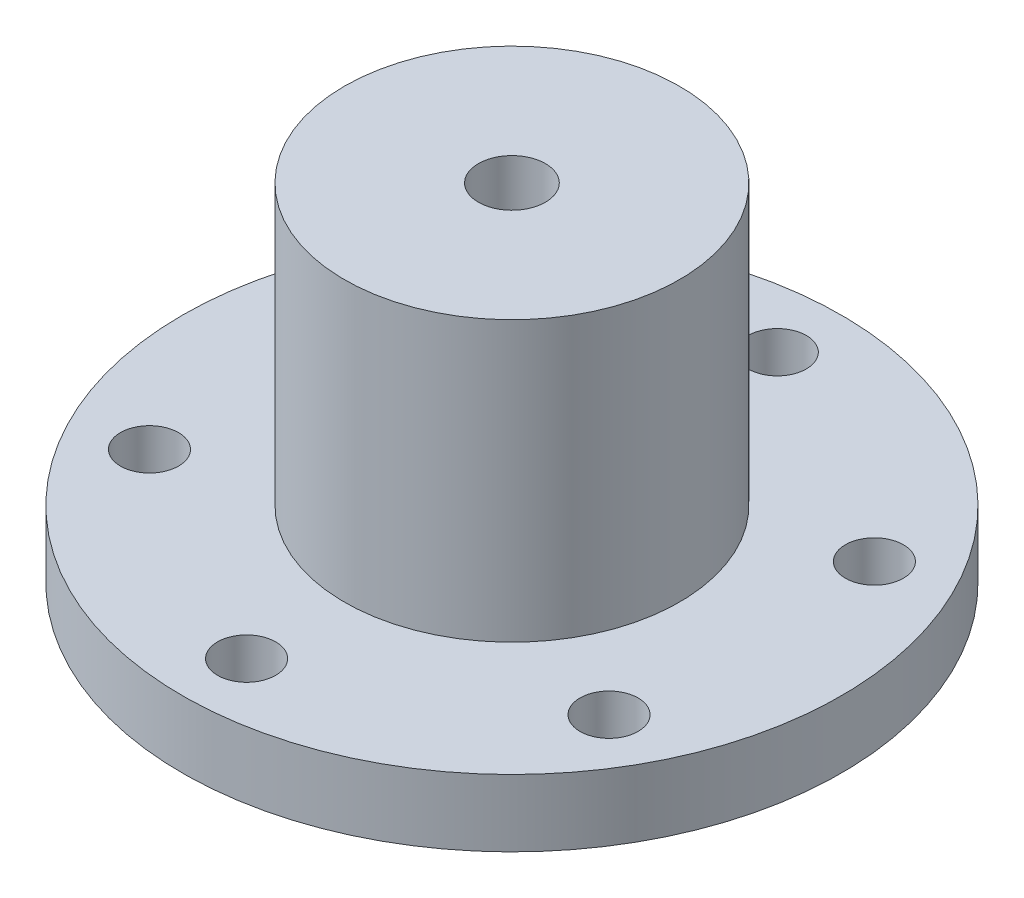
from build123d import *

# Parameters (mm, degrees)
CUT_EXTRUDE1_REACH = 53.976
SKETCH2_R          = 3
SKETCH2_R_2        = 2.6


with BuildPart() as part:
    # Sketch1 → Revolve1 (revolve)
    with BuildSketch(Plane.XY, mode=Mode.PRIVATE) as revolve1_sk:
        Polygon((0, -15.5), (29.5, -15.5), (29.5, -9.5), (15, -9.5), (15, 15.5), (0, 15.5), align=None)
    revolve(revolve1_sk.sketch.rotate(Axis((0, 0, 0), (0, -1, 0)), 180), axis=Axis((0, 0, 0), (0, -1, 0)))

    # Sketch2 → Cut-Extrude1 (cut, up to next)
    with BuildSketch(Plane(origin=(0, 15.5, 0), x_dir=(1, 0, 0), z_dir=(0, 1, 0)), mode=Mode.PRIVATE) as cut_extrude1_sk1:
        with Locations(Location((0, 0, 0), (0, 0, 180))):
            Circle(SKETCH2_R)
    cut_extrude1_tool1 = extrude(cut_extrude1_sk1.sketch, amount=-CUT_EXTRUDE1_REACH, mode=Mode.PRIVATE) & part.part
    # Sketch2 → Cut-Extrude1 (cut, up to next)
    with BuildSketch(Plane(origin=(0, 15.5, 0), x_dir=(1, 0, 0), z_dir=(0, 1, 0)), mode=Mode.PRIVATE) as cut_extrude1_sk2:
        with Locations(Location((0, 23.75, 0), (0, 0, 180))):
            Circle(SKETCH2_R_2)
    cut_extrude1_tool2 = extrude(cut_extrude1_sk2.sketch, amount=-CUT_EXTRUDE1_REACH, mode=Mode.PRIVATE) & part.part
    # Sketch2 → Cut-Extrude1 (cut, up to next)
    with BuildSketch(Plane(origin=(0, 15.5, 0), x_dir=(1, 0, 0), z_dir=(0, 1, 0)), mode=Mode.PRIVATE) as cut_extrude1_sk3:
        with Locations(Location((20.56810334, 11.875, 0), (0, 0, 180))):
            Circle(SKETCH2_R_2)
    cut_extrude1_tool3 = extrude(cut_extrude1_sk3.sketch, amount=-CUT_EXTRUDE1_REACH, mode=Mode.PRIVATE) & part.part
    # Sketch2 → Cut-Extrude1 (cut, up to next)
    with BuildSketch(Plane(origin=(0, 15.5, 0), x_dir=(1, 0, 0), z_dir=(0, 1, 0)), mode=Mode.PRIVATE) as cut_extrude1_sk4:
        with Locations(Location((20.56810334, -11.875, 0), (0, 0, 180))):
            Circle(SKETCH2_R_2)
    cut_extrude1_tool4 = extrude(cut_extrude1_sk4.sketch, amount=-CUT_EXTRUDE1_REACH, mode=Mode.PRIVATE) & part.part
    # Sketch2 → Cut-Extrude1 (cut, up to next)
    with BuildSketch(Plane(origin=(0, 15.5, 0), x_dir=(1, 0, 0), z_dir=(0, 1, 0)), mode=Mode.PRIVATE) as cut_extrude1_sk5:
        with Locations(Location((0, -23.75, 0), (0, 0, 180))):
            Circle(SKETCH2_R_2)
    cut_extrude1_tool5 = extrude(cut_extrude1_sk5.sketch, amount=-CUT_EXTRUDE1_REACH, mode=Mode.PRIVATE) & part.part
    # Sketch2 → Cut-Extrude1 (cut, up to next)
    with BuildSketch(Plane(origin=(0, 15.5, 0), x_dir=(1, 0, 0), z_dir=(0, 1, 0)), mode=Mode.PRIVATE) as cut_extrude1_sk6:
        with Locations(Location((-20.56810334, -11.875, 0), (0, 0, 180))):
            Circle(SKETCH2_R_2)
    cut_extrude1_tool6 = extrude(cut_extrude1_sk6.sketch, amount=-CUT_EXTRUDE1_REACH, mode=Mode.PRIVATE) & part.part
    # Sketch2 → Cut-Extrude1 (cut, up to next)
    with BuildSketch(Plane(origin=(0, 15.5, 0), x_dir=(1, 0, 0), z_dir=(0, 1, 0)), mode=Mode.PRIVATE) as cut_extrude1_sk7:
        with Locations(Location((-20.56810334, 11.875, 0), (0, 0, 180))):
            Circle(SKETCH2_R_2)
    cut_extrude1_tool7 = extrude(cut_extrude1_sk7.sketch, amount=-CUT_EXTRUDE1_REACH, mode=Mode.PRIVATE) & part.part
    add(cut_extrude1_tool1.solids().sort_by_distance((0, 15.5, 0))[0], mode=Mode.SUBTRACT)
    add(cut_extrude1_tool2.solids().sort_by_distance((0, 15.5, -23.75))[0], mode=Mode.SUBTRACT)
    add(cut_extrude1_tool3.solids().sort_by_distance((20.568103, 15.5, -11.875))[0], mode=Mode.SUBTRACT)
    add(cut_extrude1_tool4.solids().sort_by_distance((20.568103, 15.5, 11.875))[0], mode=Mode.SUBTRACT)
    add(cut_extrude1_tool5.solids().sort_by_distance((0, 15.5, 23.75))[0], mode=Mode.SUBTRACT)
    add(cut_extrude1_tool6.solids().sort_by_distance((-20.568103, 15.5, 11.875))[0], mode=Mode.SUBTRACT)
    add(cut_extrude1_tool7.solids().sort_by_distance((-20.568103, 15.5, -11.875))[0], mode=Mode.SUBTRACT)


solid = part.part
